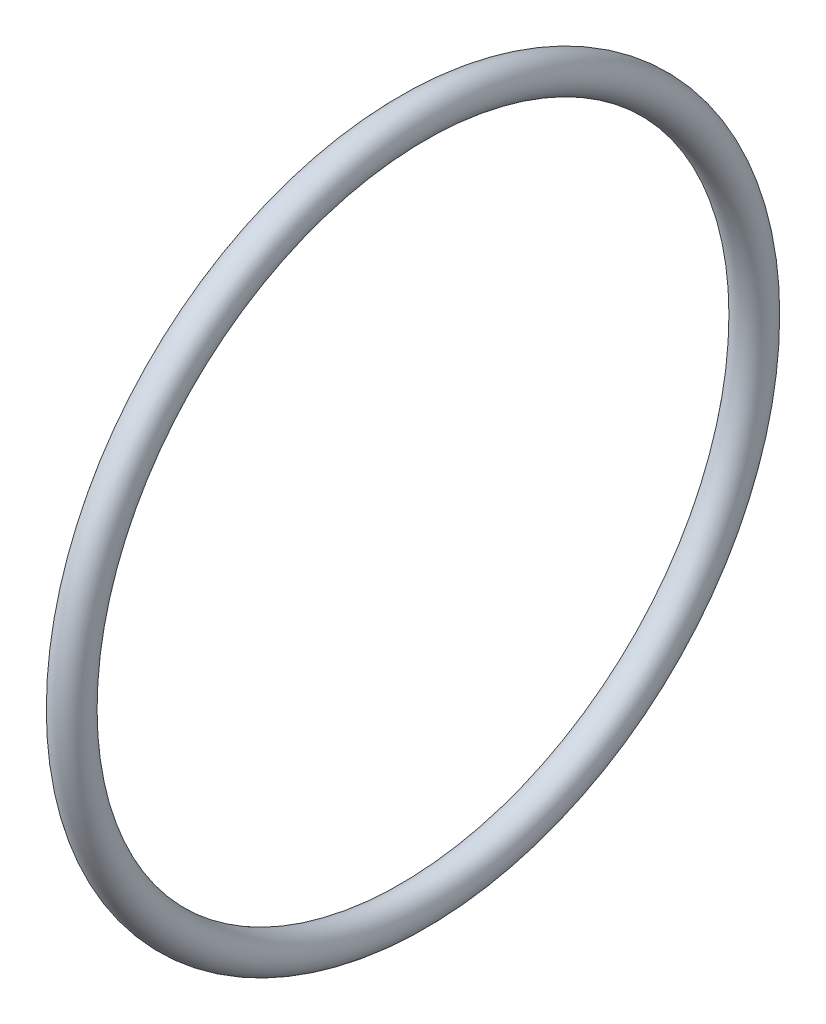
from build123d import *

# Parameters (mm, degrees)
SKETCH1_R = 1.5


with BuildPart() as part:
    # Sketch1 → Revolve1 (revolve)
    with BuildSketch(Plane.XY, mode=Mode.PRIVATE) as revolve1_sk:
        Circle(SKETCH1_R)
    revolve(revolve1_sk.sketch.rotate(Axis((-2.665122588, -28.5, 0), (1, 0, 0)), 90), axis=Axis((-2.665122588, -28.5, 0), (1, 0, 0)))


solid = part.part
